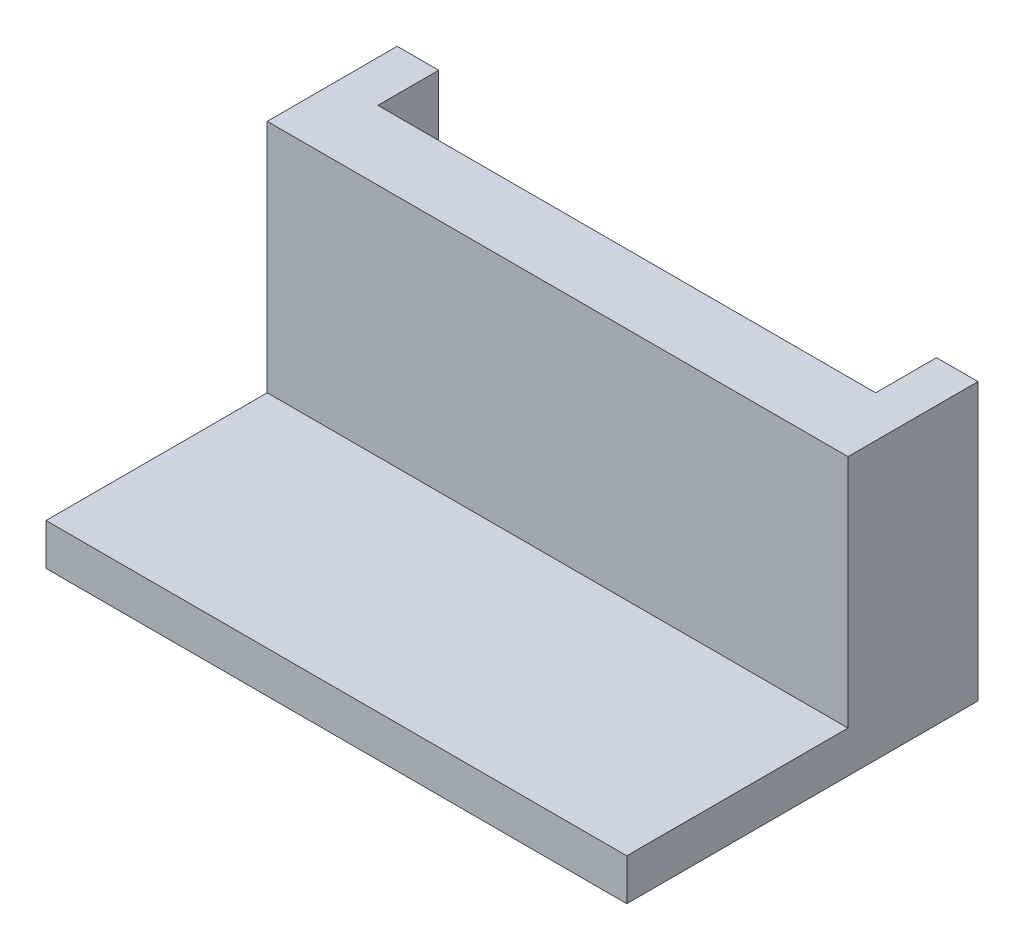
from build123d import *

# Parameters (mm, degrees)
SKETCH1_W           = 18
SKETCH1_H           = 4.7
BOSS_EXTRUDE1_DEPTH = 1.5
SKETCH2_W           = 5
SKETCH2_H           = 0.9
SKETCH2_W_2         = 18
SKETCH2_H_2         = 2.5
BOSS_EXTRUDE2_DEPTH = 4.5
SKETCH3_W           = 18
SKETCH3_H           = 2.5
BOSS_EXTRUDE3_DEPTH = 4
SKETCH4_W           = 4.7
SKETCH4_H           = 10
BOSS_EXTRUDE4_DEPTH = 1.5
SKETCH5_W           = 4.7
SKETCH5_H           = 10
BOSS_EXTRUDE5_DEPTH = 1.5
SKETCH6_W           = 21
SKETCH6_H           = 1.5
BOSS_EXTRUDE6_DEPTH = 8


with BuildPart() as part:
    # Sketch1 → Boss-Extrude1 (new body)
    with BuildSketch(Plane(origin=(0, 0, 0), x_dir=(1, 0, 0), z_dir=(0, 1, 0))):
        with Locations((5.918454936, -0.847854077)):
            Rectangle(SKETCH1_W, SKETCH1_H)
    extrude(amount=BOSS_EXTRUDE1_DEPTH)

    # Sketch2 → Boss-Extrude2 (add)
    with BuildSketch(Plane(origin=(0, 1.5, 0), x_dir=(1, 0, 0), z_dir=(0, 1, 0))):
        with Locations((-0.581545064, 1.052145923)):
            Rectangle(SKETCH2_W, SKETCH2_H)
        with Locations((12.418454936, 1.052145923)):
            Rectangle(SKETCH2_W, SKETCH2_H)
        with Locations((5.918454936, -1.947854077)):
            Rectangle(SKETCH2_W_2, SKETCH2_H_2)
    extrude(amount=BOSS_EXTRUDE2_DEPTH)

    # Sketch3 → Boss-Extrude3 (add)
    with BuildSketch(Plane(origin=(0, 6, 0), x_dir=(1, 0, 0), z_dir=(0, 1, 0))):
        with Locations((5.918454936, -1.947854077)):
            Rectangle(SKETCH3_W, SKETCH3_H)
    extrude(amount=BOSS_EXTRUDE3_DEPTH)

    # Sketch4 → Boss-Extrude4 (add)
    with BuildSketch(Plane(origin=(14.918454936, 0, 0), x_dir=(0, 0, -1), z_dir=(1, 0, 0))):
        with Locations((-0.847854077, 5)):
            Rectangle(SKETCH4_W, SKETCH4_H)
    extrude(amount=BOSS_EXTRUDE4_DEPTH)

    # Sketch5 → Boss-Extrude5 (add)
    with BuildSketch(Plane.ZY.offset(3.081545064)):
        with Locations((0.847854077, 5)):
            Rectangle(SKETCH5_W, SKETCH5_H)
    extrude(amount=BOSS_EXTRUDE5_DEPTH)

    # Sketch6 → Boss-Extrude6 (add)
    with BuildSketch(Plane.XY.offset(3.197854077)):
        with Locations((5.918454936, 0.75)):
            Rectangle(SKETCH6_W, SKETCH6_H)
    extrude(amount=BOSS_EXTRUDE6_DEPTH)


solid = part.part
